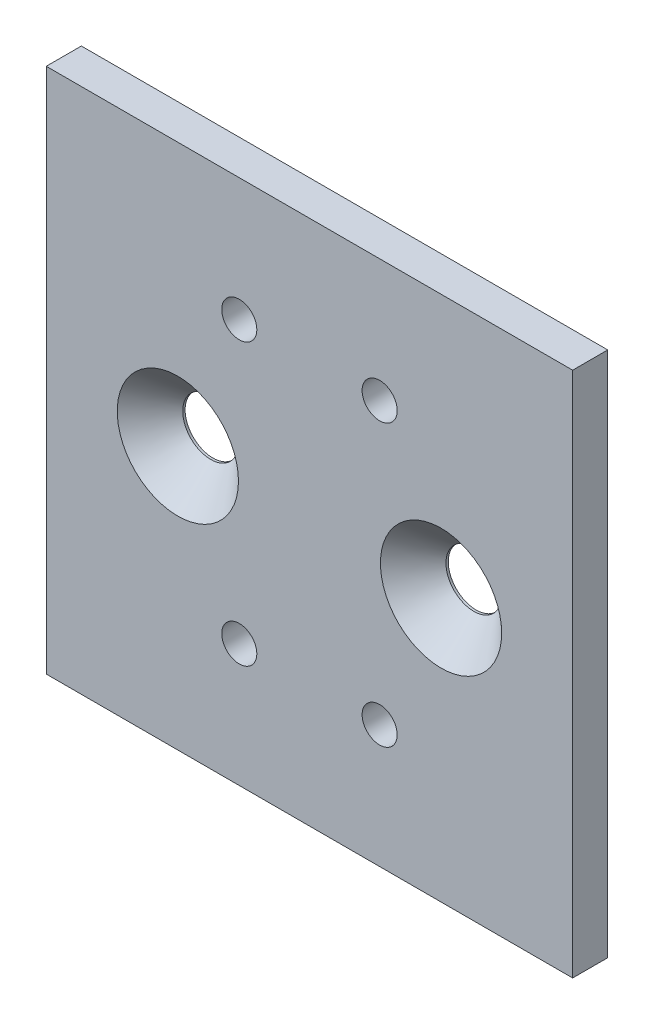
from build123d import *

# Parameters (mm, degrees)
SKETCH1_W           = 60
SKETCH1_H           = 60
SKETCH1_R           = 3.175
BOSS_EXTRUDE1_DEPTH = 2
SKETCH3_R           = 2
CUT_EXTRUDE2_DEPTH  = 85.947042326


with BuildPart() as part:
    # Sketch1 → Boss-Extrude1 (new, symmetric)
    with BuildSketch(Plane.XY):
        with Locations((30, 30)):
            Rectangle(SKETCH1_W, SKETCH1_H)
        with Locations((15, 30)):
            Circle(SKETCH1_R, mode=Mode.SUBTRACT)
        with Locations((45, 30)):
            Circle(SKETCH1_R, mode=Mode.SUBTRACT)
    extrude(amount=BOSS_EXTRUDE1_DEPTH, both=True)

    # Cut-Extrude1 cone 1 section (through the dimple's axis) → Cut-Extrude1 (revolve, cut)
    with BuildSketch(Plane(origin=(15, 30, 2), x_dir=(0, -1, 0), z_dir=(1, 0, 0))):
        Polygon((0, 0), (6.9088, 0), (0, 6.9088), align=None)
    revolve(axis=Axis((15, 30, 2), (0, 0, -1)), mode=Mode.SUBTRACT)

    # Cut-Extrude1 cone 2 section (through the dimple's axis) → Cut-Extrude1 cone 2 (revolve, cut)
    with BuildSketch(Plane(origin=(45, 30, 2), x_dir=(0, -1, 0), z_dir=(1, 0, 0))):
        Polygon((0, 0), (6.9088, 0), (0, 6.9088), align=None)
    revolve(axis=Axis((45, 30, 2), (0, 0, -1)), mode=Mode.SUBTRACT)

    # Sketch3 → Cut-Extrude2 (cut, through all)
    with BuildSketch(Plane.XY.offset(2)):
        with Locations((22, 14)):
            Circle(SKETCH3_R)
        with Locations((38, 14)):
            Circle(SKETCH3_R)
        with Locations((38, 46)):
            Circle(SKETCH3_R)
        with Locations((22, 46)):
            Circle(SKETCH3_R)
    extrude(amount=-CUT_EXTRUDE2_DEPTH, mode=Mode.SUBTRACT)


solid = part.part
